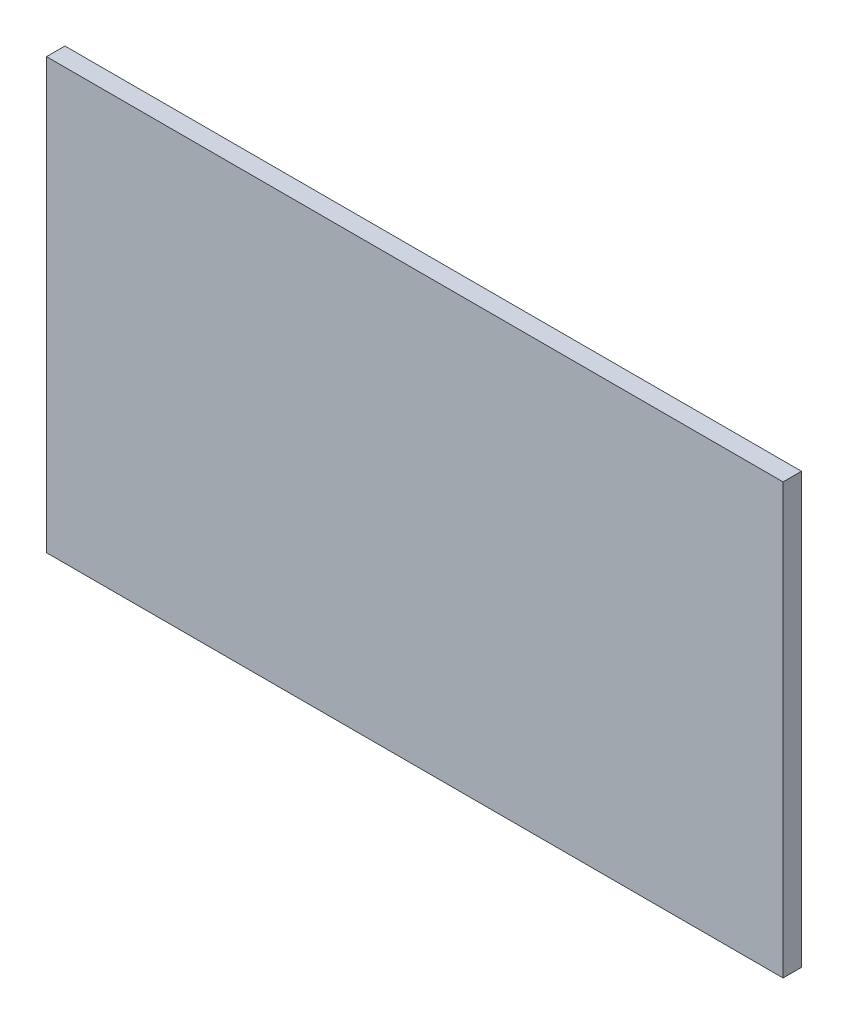
from build123d import *

# Parameters (mm, degrees)
SKETCH1_W           = 60
SKETCH1_H           = 15
BOSS_EXTRUDE1_DEPTH = 3
BOSS_EXTRUDE2_DEPTH = 6
CUT_EXTRUDE1_DEPTH  = 34.972930401
SKETCH5_W           = 60
SKETCH5_H           = 1.5
BOSS_EXTRUDE3_DEPTH = 10


with BuildPart() as part:
    # Sketch1 → Boss-Extrude1 (new body)
    with BuildSketch(Plane.XY):
        Rectangle(SKETCH1_W, SKETCH1_H)
    extrude(amount=BOSS_EXTRUDE1_DEPTH)

    # Sketch3 → Boss-Extrude2 (add)
    with BuildSketch(Plane(origin=(0, -2.5, 0), x_dir=(-1, 0, 0), z_dir=(0, -1, 0))):
        Polygon((-14.5, 0), (-17.5, 0), (-17.5, 3.4), (-18.9, 3.4), (-18.9, 5.4), (-13.1, 5.4), (-13.1, 3.4), (-14.5, 3.4), align=None)
        Polygon((14.5, 3.4), (14.5, 0), (17.5, 0), (17.5, 3.4), (18.9, 3.4), (18.9, 5.4), (13.1, 5.4), (13.1, 3.4), align=None)
    extrude(amount=-BOSS_EXTRUDE2_DEPTH)

    # Sketch4 → Cut-Extrude1 (cut, through all)
    with BuildSketch(Plane(origin=(0, 7.5, 0), x_dir=(1, 0, 0), z_dir=(0, 1, 0))):
        Polygon((30, 0), (22, 0), (23.5, -1.5), (30, -1.5), align=None)
        Polygon((0, 0), (0, -1.5), (8.5, -1.5), (10, 0), align=None)
    cut_extrude1 = extrude(amount=-CUT_EXTRUDE1_DEPTH, mode=Mode.SUBTRACT)

    # Mirror1: Cut-Extrude1 across plane
    add(cut_extrude1.mirror(Plane(origin=(0, 0, 0), x_dir=(0, 0, 1), z_dir=(1, 0, 0))), mode=Mode.SUBTRACT)

    # Sketch5 → Boss-Extrude3 (add)
    with BuildSketch(Plane(origin=(0, 7.5, 0), x_dir=(1, 0, 0), z_dir=(0, 1, 0))):
        with Locations((0, -2.25)):
            Rectangle(SKETCH5_W, SKETCH5_H)
    boss_extrude3 = extrude(amount=BOSS_EXTRUDE3_DEPTH)

    # Mirror2: Boss-Extrude3 across plane
    add(boss_extrude3.mirror(Plane.ZX))


solid = part.part
